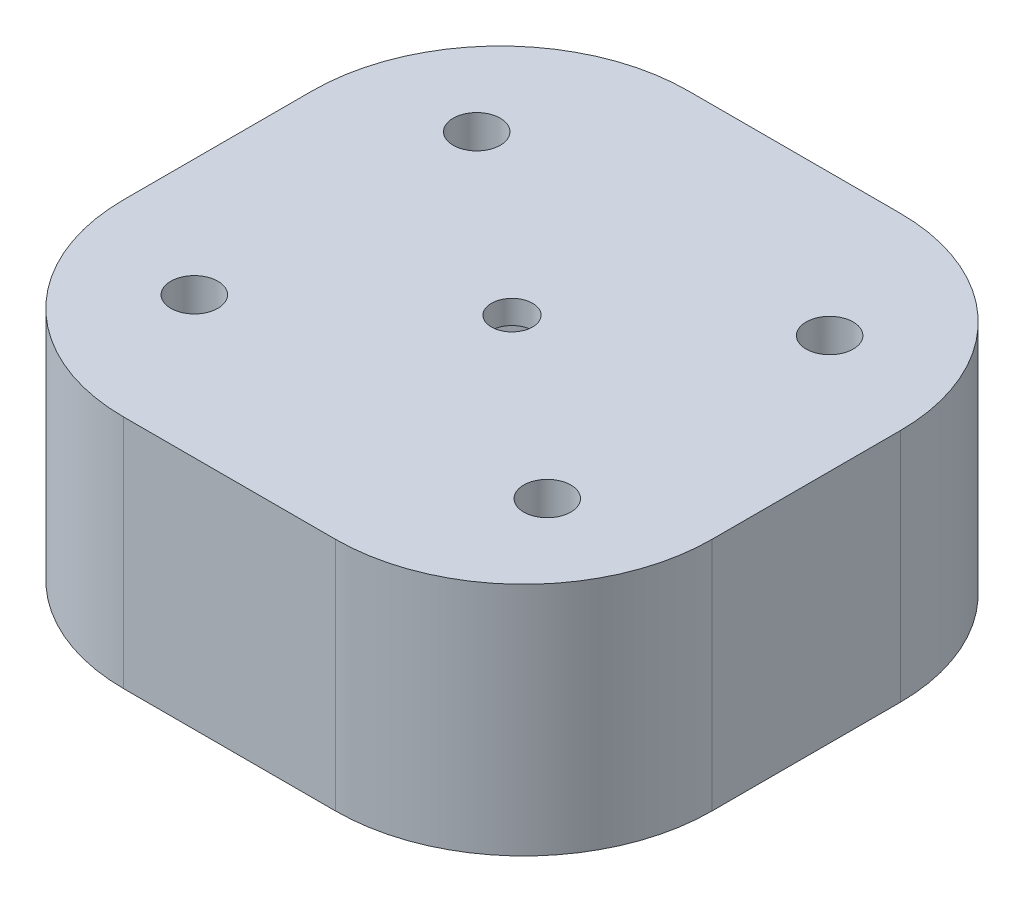
from build123d import *

# Parameters (mm, degrees)
BOSS_EXTRUDE1_DEPTH = 18
SKETCH2_R           = 2
SKETCH2_R_2         = 1.75
BOSS_EXTRUDE3_DEPTH = 2
CUT_EXTRUDE1_START  = -10
SKETCH3_R           = 2
CUT_EXTRUDE1_DEPTH  = 10


with BuildPart() as part:
    # Sketch1 → Boss-Extrude1 (new body)
    with BuildSketch(Plane(origin=(0, 0, 0), x_dir=(1, 0, 0), z_dir=(0, 1, 0))):
        with BuildLine():
            Line((-9.000000373, 24.000000209), (9.000000373, 24.000000209))
            ThreePointArc((9.000000373, 24.000000209), (20.313708872, 19.313708708), (25.000000373, 8.000000209))
            Line((25.000000373, 8.000000209), (25.000000373, -8.000000209))
            ThreePointArc((25.000000373, -8.000000209), (20.313708872, -19.313708708), (9.000000373, -24.000000209))
            Line((9.000000373, -24.000000209), (-9.000000373, -24.000000209))
            ThreePointArc((-9.000000373, -24.000000209), (-20.313708872, -19.313708708), (-25.000000373, -8.000000209))
            Line((-25.000000373, -8.000000209), (-25.000000373, 8.000000209))
            ThreePointArc((-25.000000373, 8.000000209), (-20.313708872, 19.313708708), (-9.000000373, 24.000000209))
        make_face()
        Polygon((0, 7.216878365), (-6.25, 3.608439182), (-6.25, -3.608439182), (0, -7.216878365), (6.25, -3.608439182), (6.25, 3.608439182), align=None, mode=Mode.SUBTRACT)
    extrude(amount=BOSS_EXTRUDE1_DEPTH)

    # Sketch2 → Boss-Extrude3 (add)
    with BuildSketch(Plane(origin=(0, 18, 0), x_dir=(1, 0, 0), z_dir=(0, 1, 0))):
        with BuildLine():
            Line((-9.000000373, 24.000000209), (9.000000373, 24.000000209))
            ThreePointArc((9.000000373, 24.000000209), (20.313708872, 19.313708708), (25.000000373, 8.000000209))
            Line((25.000000373, 8.000000209), (25.000000373, -8.000000209))
            ThreePointArc((25.000000373, -8.000000209), (20.313708872, -19.313708708), (9.000000373, -24.000000209))
            Line((9.000000373, -24.000000209), (-9.000000373, -24.000000209))
            ThreePointArc((-9.000000373, -24.000000209), (-20.313708872, -19.313708708), (-25.000000373, -8.000000209))
            Line((-25.000000373, -8.000000209), (-25.000000373, 8.000000209))
            ThreePointArc((-25.000000373, 8.000000209), (-20.313708872, 19.313708708), (-9.000000373, 24.000000209))
        make_face()
        with Locations(Location((-14.999999943, 12.000001696, 0), (0, 0, 270))):
            Circle(SKETCH2_R, mode=Mode.SUBTRACT)
        with Locations(Location((14.999999943, 12.000001696, 0), (0, 0, 90))):
            Circle(SKETCH2_R, mode=Mode.SUBTRACT)
        with Locations(Location((14.999999943, -12.000001696, 0), (0, 0, 270))):
            Circle(SKETCH2_R, mode=Mode.SUBTRACT)
        with Locations(Location((-14.999999943, -12.000001696, 0), (0, 0, 90))):
            Circle(SKETCH2_R, mode=Mode.SUBTRACT)
        with Locations(Location((0, 0, 0), (0, 0, 270))):
            Circle(SKETCH2_R_2, mode=Mode.SUBTRACT)
    extrude(amount=BOSS_EXTRUDE3_DEPTH)

    # Sketch3 → Cut-Extrude1 (cut)
    with BuildSketch(Plane(origin=(0, 20, 0), x_dir=(1, 0, 0), z_dir=(0, 1, 0)).offset(CUT_EXTRUDE1_START)):
        with Locations(Location((-14.999999943, 12.000001696, 0), (0, 0, 270))):
            Circle(SKETCH3_R)
        with Locations(Location((14.999999943, 12.000001696, 0), (0, 0, 90))):
            Circle(SKETCH3_R)
        with Locations(Location((14.999999943, -12.000001696, 0), (0, 0, 270))):
            Circle(SKETCH3_R)
        with Locations(Location((-14.999999943, -12.000001696, 0), (0, 0, 90))):
            Circle(SKETCH3_R)
    extrude(amount=CUT_EXTRUDE1_DEPTH, mode=Mode.SUBTRACT)


solid = part.part
